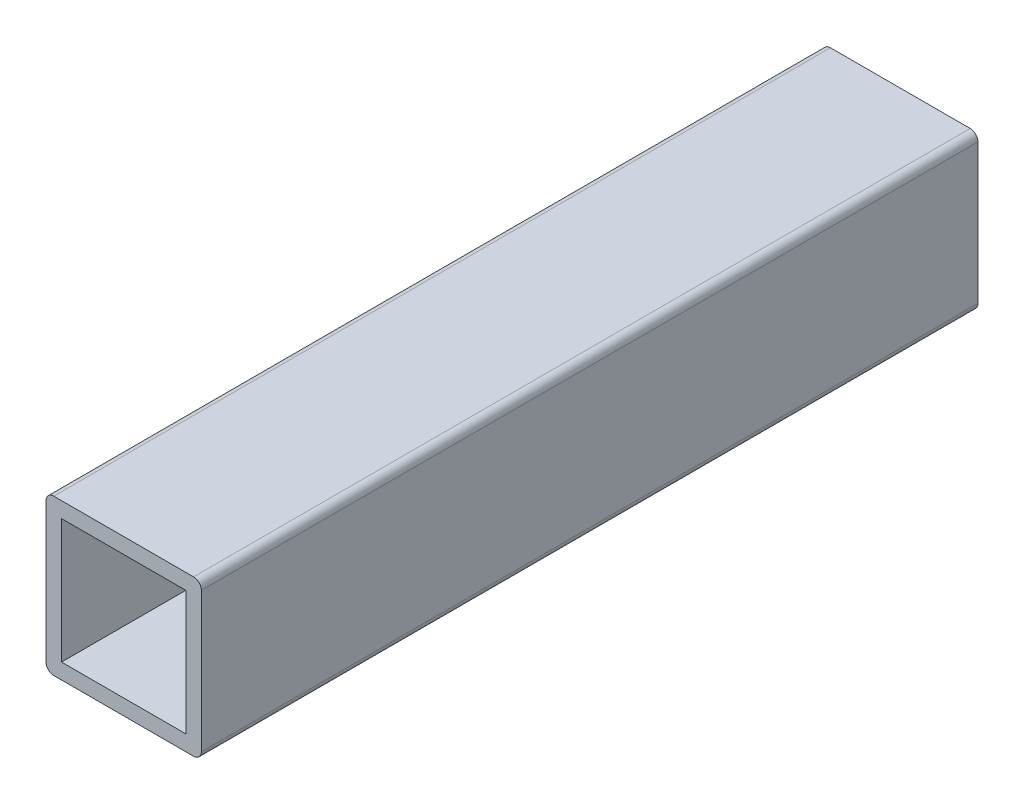
from build123d import *

# Parameters (mm, degrees)
BOSS_EXTRUDE1_DEPTH      = 914.4
BOSS_EXTRUDE1_DEPTH_BACK = 914.4
SKETCH1_W                = 31.75
SKETCH1_H                = 31.75
SKETCH1_W_2              = 25.4
SKETCH1_H_2              = 25.4
FILLET1_R                = 1.5875
SKETCH5_W                = 25.4
SKETCH5_H                = 25.4
CUT_EXTRUDE1_DEPTH       = 1670.05


with BuildPart() as part:
    # Sketch1 → Boss-Extrude1 (new, two sides: drawn at the far end of the back side and taken through both)
    with BuildSketch(Plane.XY.offset(-BOSS_EXTRUDE1_DEPTH_BACK)):
        Rectangle(SKETCH1_W, SKETCH1_H)
        Rectangle(SKETCH1_W_2, SKETCH1_H_2, mode=Mode.SUBTRACT)
    extrude(amount=BOSS_EXTRUDE1_DEPTH + BOSS_EXTRUDE1_DEPTH_BACK)

    # Fillet1
    fillet1_edges = [part.edges().sort_by_distance(p)[0] for p in [
        (15.875, -15.875, 0),
        (-15.875, -15.875, 0),
        (-15.875, 15.875, 0),
        (15.875, 15.875, 0),
    ]]
    fillet(fillet1_edges, radius=FILLET1_R)

    # Sketch5 → Cut-Extrude1 (cut)
    with BuildSketch(Plane.XY.offset(914.4)):
        with BuildLine():
            Line((-14.2875, 15.875), (14.2875, 15.875))
            ThreePointArc((14.2875, 15.875), (15.410032015, 15.410032015), (15.875, 14.2875))
            Line((15.875, 14.2875), (15.875, -14.2875))
            ThreePointArc((15.875, -14.2875), (15.410032015, -15.410032015), (14.2875, -15.875))
            Line((14.2875, -15.875), (-14.2875, -15.875))
            ThreePointArc((-14.2875, -15.875), (-15.410032015, -15.410032015), (-15.875, -14.2875))
            Line((-15.875, -14.2875), (-15.875, 14.2875))
            ThreePointArc((-15.875, 14.2875), (-15.410032015, 15.410032015), (-14.2875, 15.875))
        make_face()
        Rectangle(SKETCH5_W, SKETCH5_H, mode=Mode.SUBTRACT)
    extrude(amount=-CUT_EXTRUDE1_DEPTH, mode=Mode.SUBTRACT)


solid = part.part
